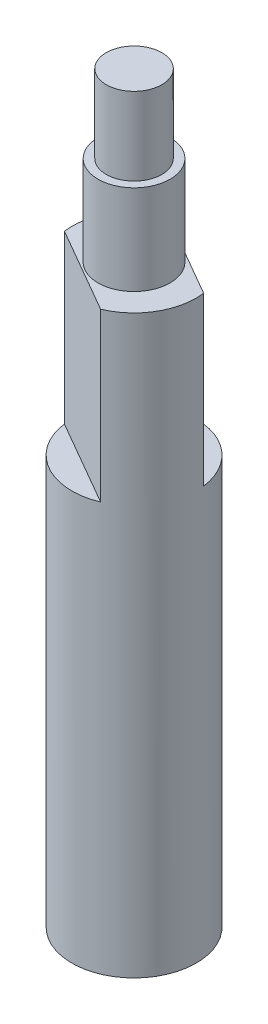
from build123d import *

# Parameters (mm, degrees)
SKETCH1_W           = 5.4864
SKETCH1_H           = 50.8
CUT_EXTRUDE1_DEPTH  = 14.732
CUT_EXTRUDE2_DEPTH  = 14.732
SKETCH4_R           = 3.175
BOSS_EXTRUDE1_DEPTH = 7.9248
SKETCH5_R           = 2.4511
BOSS_EXTRUDE2_DEPTH = 6.858


with BuildPart() as part:
    # Sketch1 → Revolve1 (revolve)
    with BuildSketch(Plane.XY, mode=Mode.PRIVATE) as revolve1_sk:
        with Locations((628.657823135, 122.745244002)):
            Rectangle(SKETCH1_W, SKETCH1_H)
    revolve(revolve1_sk.sketch.rotate(Axis((625.914623135, 148.145244002, 0), (0, -1, 0)), 270), axis=Axis((625.914623135, 148.145244002, 0), (0, -1, 0)))

    # Sketch2 → Cut-Extrude1 (cut)
    with BuildSketch(Plane(origin=(0, 148.145244002, 0), x_dir=(-1, 0, 0), z_dir=(0, 1, 0))):
        with BuildLine():
            Line((-628.028719536, 5.062724698), (-620.473126733, 0.700501159))
            ThreePointArc((-620.473126733, 0.700501159), (-623.171423135, 4.751361775), (-628.028719536, 5.062724698))
        make_face()
    extrude(amount=-CUT_EXTRUDE1_DEPTH, mode=Mode.SUBTRACT)

    # Sketch3 → Cut-Extrude2 (cut)
    with BuildSketch(Plane(origin=(0, 148.145244002, 0), x_dir=(-1, 0, 0), z_dir=(0, 1, 0))):
        with BuildLine():
            Line((-623.800526733, -5.062724698), (-631.356119536, -0.700501159))
            ThreePointArc((-631.356119536, -0.700501159), (-628.657823135, -4.751361775), (-623.800526733, -5.062724698))
        make_face()
    extrude(amount=-CUT_EXTRUDE2_DEPTH, mode=Mode.SUBTRACT)

    # Sketch4 → Boss-Extrude1 (add)
    with BuildSketch(Plane(origin=(0, 148.145244002, 0), x_dir=(-1, 0, 0), z_dir=(0, 1, 0))):
        with Locations(Location((-625.914623135, 0, 0), (0, 0, 90))):
            Circle(SKETCH4_R)
    extrude(amount=BOSS_EXTRUDE1_DEPTH)

    # Sketch5 → Boss-Extrude2 (add)
    with BuildSketch(Plane(origin=(0, 156.070044002, 0), x_dir=(-1, 0, 0), z_dir=(0, 1, 0))):
        with Locations(Location((-625.914623135, 0, 0), (0, 0, 270))):
            Circle(SKETCH5_R)
    extrude(amount=BOSS_EXTRUDE2_DEPTH)


solid = part.part
